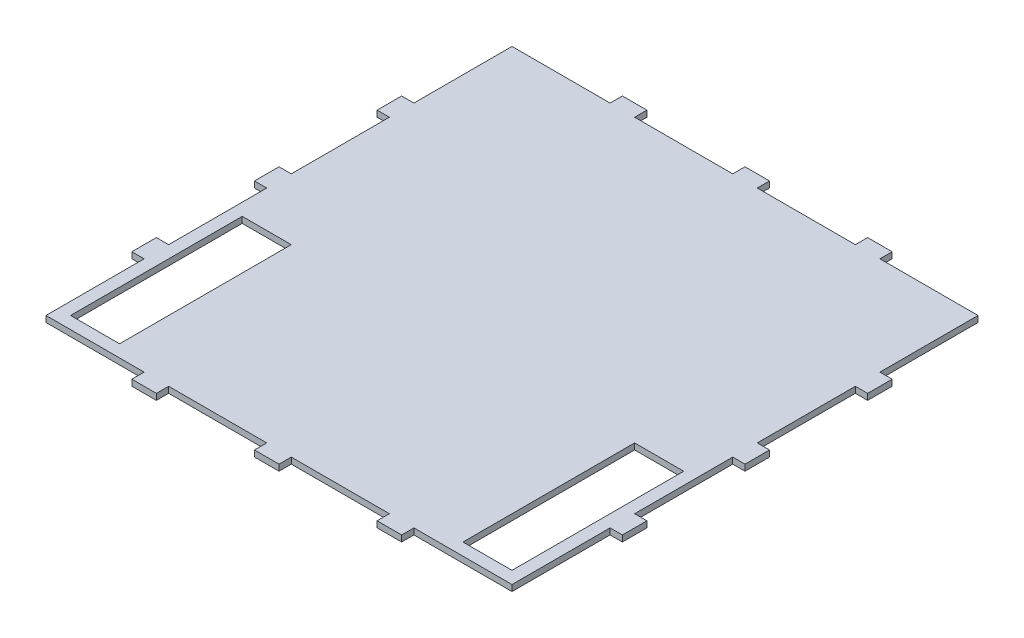
from build123d import *

# Parameters (mm, degrees)
SKETCH1_W           = 12.7
SKETCH1_H           = 44.45
BOSS_EXTRUDE1_DEPTH = 1.5875


with BuildPart() as part:
    # Sketch1 → Boss-Extrude1 (new body)
    with BuildSketch(Plane(origin=(0, 0, 0), x_dir=(1, 0, 0), z_dir=(0, 1, 0))):
        Polygon((3.175, 63.5), (-3.175, 63.5), (-3.175, 60.325), (-28.575, 60.325), (-28.575, 63.5), (-34.925, 63.5), (-34.925, 60.325), (-60.325, 60.325), (-60.325, 34.925), (-63.5, 34.925), (-63.5, 28.575), (-60.325, 28.575), (-60.325, 3.175), (-63.5, 3.175), (-63.5, -3.175), (-60.325, -3.175), (-60.325, -28.575), (-63.5, -28.575), (-63.5, -34.925), (-60.325, -34.925), (-60.325, -60.325), (-34.925, -60.325), (-34.925, -63.5), (-28.575, -63.5), (-28.575, -60.325), (-3.175, -60.325), (-3.175, -63.5), (3.175, -63.5), (3.175, -60.325), (28.575, -60.325), (28.575, -63.5), (34.925, -63.5), (34.925, -60.325), (60.325, -60.325), (60.325, -34.925), (63.5, -34.925), (63.5, -28.575), (60.325, -28.575), (60.325, -3.175), (63.5, -3.175), (63.5, 3.175), (60.325, 3.175), (60.325, 28.575), (63.5, 28.575), (63.5, 34.925), (60.325, 34.925), (60.325, 60.325), (34.925, 60.325), (34.925, 63.5), (28.575, 63.5), (28.575, 60.325), (3.175, 60.325), align=None)
        with Locations((50.8, -34.925)):
            Rectangle(SKETCH1_W, SKETCH1_H, mode=Mode.SUBTRACT)
        with Locations((-50.8, -34.925)):
            Rectangle(SKETCH1_W, SKETCH1_H, mode=Mode.SUBTRACT)
    extrude(amount=BOSS_EXTRUDE1_DEPTH)


solid = part.part
